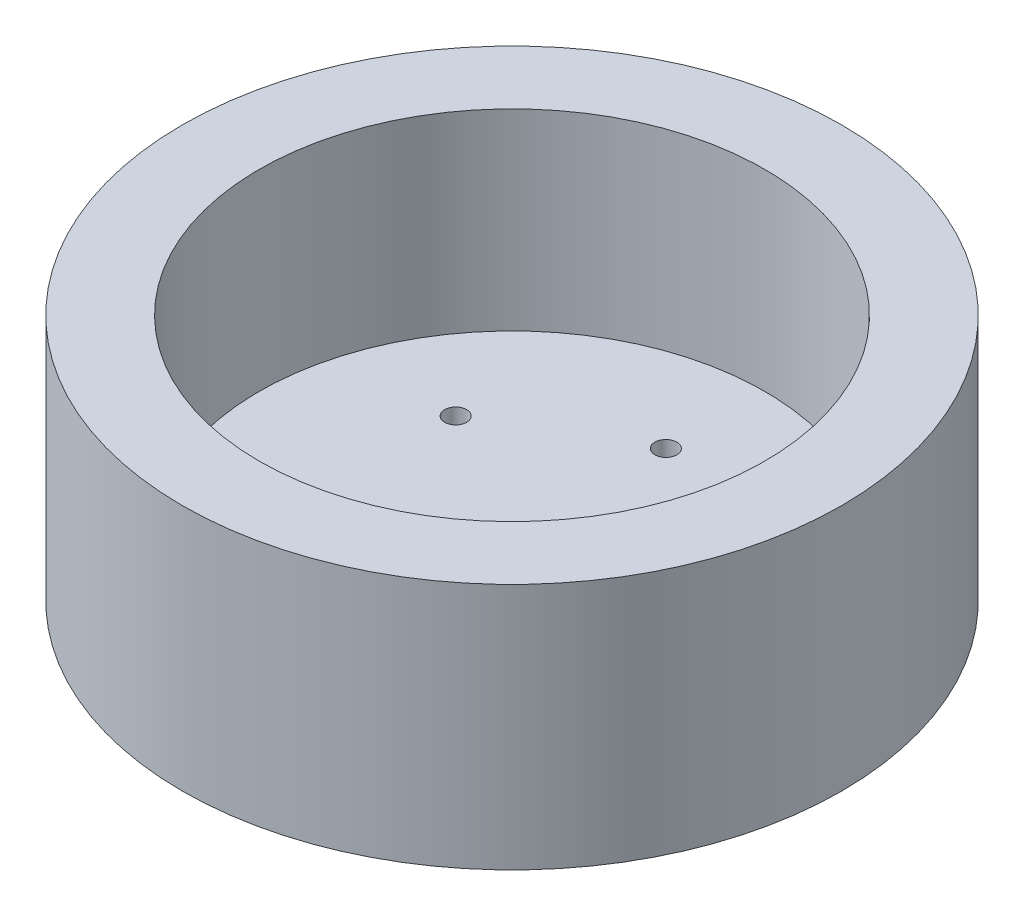
from build123d import *

# Parameters (mm, degrees)
SKETCH1_R           = 60
SKETCH1_R_2         = 2
BOSS_EXTRUDE1_DEPTH = 10
SKETCH2_R           = 60
SKETCH2_R_2         = 46
BOSS_EXTRUDE2_DEPTH = 35


with BuildPart() as part:
    # Sketch1 → Boss-Extrude1 (new body)
    with BuildSketch(Plane(origin=(0, 0, 0), x_dir=(1, 0, 0), z_dir=(0, 1, 0))):
        with Locations(Location((0, 0, 0), (0, 0, 270))):
            Circle(SKETCH1_R)
        with Locations(Location((0, 28, 0), (0, 0, 270))):
            Circle(SKETCH1_R_2, mode=Mode.SUBTRACT)
        with Locations(Location((24.248711306, 14, 0), (0, 0, 270))):
            Circle(SKETCH1_R_2, mode=Mode.SUBTRACT)
        with Locations(Location((24.248711306, -14, 0), (0, 0, 270))):
            Circle(SKETCH1_R_2, mode=Mode.SUBTRACT)
        with Locations(Location((0, -28, 0), (0, 0, 270))):
            Circle(SKETCH1_R_2, mode=Mode.SUBTRACT)
        with Locations(Location((-24.248711306, -14, 0), (0, 0, 270))):
            Circle(SKETCH1_R_2, mode=Mode.SUBTRACT)
        with Locations(Location((-24.248711306, 14, 0), (0, 0, 270))):
            Circle(SKETCH1_R_2, mode=Mode.SUBTRACT)
    extrude(amount=BOSS_EXTRUDE1_DEPTH)

    # Sketch2 → Boss-Extrude2 (add)
    with BuildSketch(Plane(origin=(0, 10, 0), x_dir=(1, 0, 0), z_dir=(0, 1, 0))):
        with Locations(Location((0, 0, 0), (0, 0, 270))):
            Circle(SKETCH2_R)
        with Locations(Location((0, 0, 0), (0, 0, 270))):
            Circle(SKETCH2_R_2, mode=Mode.SUBTRACT)
    extrude(amount=BOSS_EXTRUDE2_DEPTH)


solid = part.part
